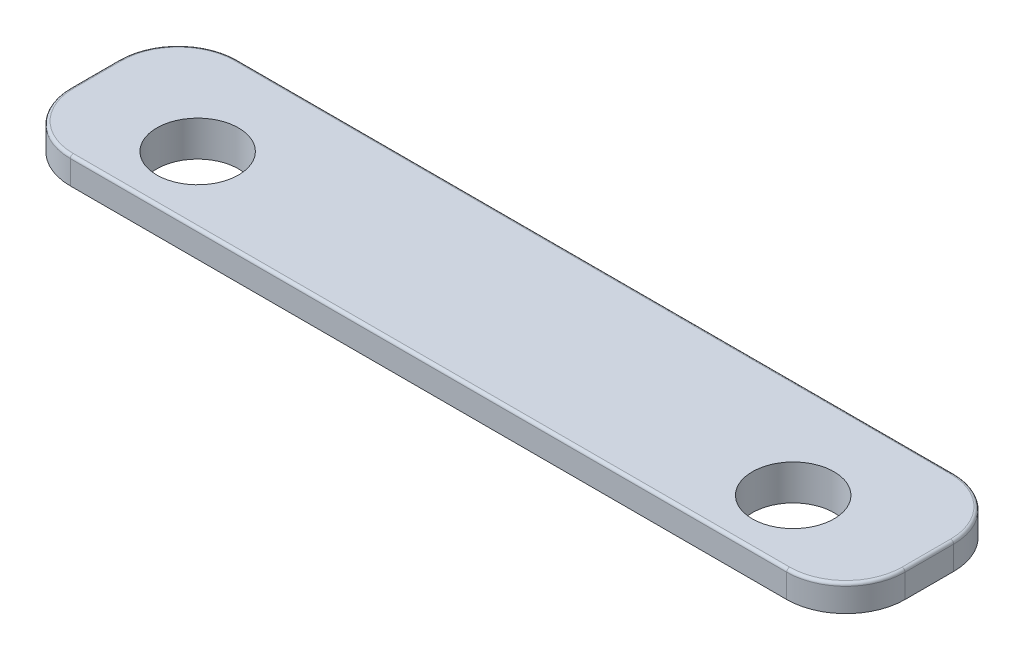
from build123d import *

# Parameters (mm, degrees)
SKETCH1_W           = 35.814
SKETCH1_H           = 7.1628
BOSS_EXTRUDE1_DEPTH = 1.524
FILLET1_R           = 2.54
FILLET2_R           = 0.127
BOSS_EXTRUDE2_DEPTH = 0.381
SKETCH5_R           = 1.2827
CUT_EXTRUDE2_DEPTH  = 2.54
SKETCH9_R           = 1.7526
CUT_EXTRUDE5_DEPTH  = 1.016
CUT_EXTRUDE6_START  = -0.381
CUT_EXTRUDE6_DEPTH  = 0.381
SKETCH17_R          = 1.7526
CUT_EXTRUDE11_DEPTH = 19.289869627
SKETCH18_R          = 1.7526
CUT_EXTRUDE12_DEPTH = 19.325109849
SKETCH19_R          = 0.381
CUT_EXTRUDE13_DEPTH = 0.127
SKETCH20_R          = 0.1905
CUT_EXTRUDE14_DEPTH = 0.762


with BuildPart() as part:
    # Sketch1 → Boss-Extrude1 (new body)
    with BuildSketch(Plane(origin=(0, 0, 0), x_dir=(1, 0, 0), z_dir=(0, 1, 0))):
        Rectangle(SKETCH1_W, SKETCH1_H)
    extrude(amount=BOSS_EXTRUDE1_DEPTH)

    # Fillet1
    fillet1_edges = [part.edges().sort_by_distance(p)[0] for p in [
        (-17.907, 0.762, -3.5814),
        (17.907, 0.762, -3.5814),
        (17.907, 0.762, 3.5814),
        (-17.907, 0.762, 3.5814),
    ]]
    fillet(fillet1_edges, radius=FILLET1_R)

    # Fillet2
    fillet2_edges = [part.edges().sort_by_distance(p)[0] for p in [
        (-17.907, 1.524, 0),
        (0, 1.524, -3.5814),
        (0, 1.524, 3.5814),
        (17.907, 1.524, 0),
        (17.163051224, 1.524, 2.837451224),
        (17.163051224, 1.524, -2.837451224),
        (-17.163051224, 1.524, 2.837451224),
        (-17.163051224, 1.524, -2.837451224),
    ]]
    fillet(fillet2_edges, radius=FILLET2_R)

    # Sketch4 → Boss-Extrude2 (add)
    with BuildSketch(Plane.XZ.offset(-0.381)):
        with BuildLine():
            Line((-15.367, 2.9464), (-15.367, 3.2004))
            ThreePointArc((-15.367, 3.2004), (-16.893643541, 2.568043541), (-17.526, 1.0414))
            Line((-17.526, 1.0414), (-17.526, -1.0414))
            ThreePointArc((-17.526, -1.0414), (-16.893643541, -2.568043541), (-15.367, -3.2004))
            Line((-15.367, -3.2004), (-15.367, -2.9464))
            ThreePointArc((-15.367, -2.9464), (-16.714038418, -2.388438418), (-17.272, -1.0414))
            Line((-17.272, -1.0414), (-17.272, 1.0414))
            ThreePointArc((-17.272, 1.0414), (-16.714038418, 2.388438418), (-15.367, 2.9464))
        make_face()
    boss_extrude2 = extrude(amount=BOSS_EXTRUDE2_DEPTH)

    # Mirror3: Boss-Extrude2 across plane
    add(boss_extrude2.mirror(Plane(origin=(0, 0, 0), x_dir=(0, 0, 1), z_dir=(1, 0, 0))))

    # Sketch5 → Cut-Extrude2 (cut)
    with BuildSketch(Plane(origin=(0, 1.524, 0), x_dir=(1, 0, 0), z_dir=(0, 1, 0))):
        with Locations(Location((-12.7762, -0.7112, 0), (0, 0, 270))):
            Circle(SKETCH5_R)
    cut_extrude2 = extrude(amount=-CUT_EXTRUDE2_DEPTH, mode=Mode.SUBTRACT)

    # Sketch9 → Cut-Extrude5 (cut)
    with BuildSketch(Plane(origin=(0, 1.524, 0), x_dir=(1, 0, 0), z_dir=(0, 1, 0))):
        with Locations(Location((-12.7762, -0.7112, 0), (0, 0, 270))):
            Circle(SKETCH9_R)
    cut_extrude5 = extrude(amount=-CUT_EXTRUDE5_DEPTH, mode=Mode.SUBTRACT)

    # Mirror4: Cut-Extrude2, Cut-Extrude5 across plane
    add(cut_extrude2.mirror(Plane(origin=(0, 0, 0), x_dir=(0, 0, 1), z_dir=(1, 0, 0))), mode=Mode.SUBTRACT)
    add(cut_extrude5.mirror(Plane(origin=(0, 0, 0), x_dir=(0, 0, 1), z_dir=(1, 0, 0))), mode=Mode.SUBTRACT)

    # Sketch10 → Cut-Extrude6 (cut)
    with BuildSketch(Plane.XZ.offset(CUT_EXTRUDE6_START)):
        with BuildLine():
            Line((17.907, 1.0414), (17.907, -1.0414))
            ThreePointArc((17.907, -1.0414), (17.163051224, -2.837451224), (15.367, -3.5814))
            Line((15.367, -3.5814), (-15.367, -3.5814))
            ThreePointArc((-15.367, -3.5814), (-17.163051224, -2.837451224), (-17.907, -1.0414))
            Line((-17.907, -1.0414), (-17.907, 1.0414))
            ThreePointArc((-17.907, 1.0414), (-17.163051224, 2.837451224), (-15.367, 3.5814))
            Line((-15.367, 3.5814), (15.367, 3.5814))
            ThreePointArc((15.367, 3.5814), (17.163051224, 2.837451224), (17.907, 1.0414))
        make_face()
        with BuildLine():
            Line((-15.367, 2.9464), (15.367, 2.9464))
            ThreePointArc((15.367, 2.9464), (16.714038418, 2.388438418), (17.272, 1.0414))
            Line((17.272, 1.0414), (17.272, -1.0414))
            ThreePointArc((17.272, -1.0414), (16.714038418, -2.388438418), (15.367, -2.9464))
            Line((15.367, -2.9464), (-15.367, -2.9464))
            ThreePointArc((-15.367, -2.9464), (-16.714038418, -2.388438418), (-17.272, -1.0414))
            Line((-17.272, -1.0414), (-17.272, 1.0414))
            ThreePointArc((-17.272, 1.0414), (-16.714038418, 2.388438418), (-15.367, 2.9464))
        make_face(mode=Mode.SUBTRACT)
    extrude(amount=CUT_EXTRUDE6_DEPTH, mode=Mode.SUBTRACT)

    # Sketch17 → Cut-Extrude11 (cut, through all)
    with BuildSketch(Plane(origin=(0, 0.508, 0), x_dir=(1, 0, 0), z_dir=(0, 1, 0))):
        with Locations(Location((-12.7762, -0.7112, 0), (0, 0, 270))):
            Circle(SKETCH17_R)
    extrude(amount=-CUT_EXTRUDE11_DEPTH, mode=Mode.SUBTRACT)

    # Sketch18 → Cut-Extrude12 (cut, through all)
    with BuildSketch(Plane(origin=(0, 1.524, 0), x_dir=(1, 0, 0), z_dir=(0, 1, 0))):
        with Locations(Location((12.7762, -0.7112, 0), (0, 0, 270))):
            Circle(SKETCH18_R)
    extrude(amount=-CUT_EXTRUDE12_DEPTH, mode=Mode.SUBTRACT)

    # Sketch19 → Cut-Extrude13 (cut)
    with BuildSketch(Plane.XZ):
        with Locations(Location((0, 0.7112, 0), (0, 0, 270))):
            Circle(SKETCH19_R)
    extrude(amount=-CUT_EXTRUDE13_DEPTH, mode=Mode.SUBTRACT)

    # Sketch20 → Cut-Extrude14 (cut)
    with BuildSketch(Plane.XZ):
        with Locations(Location((0, 0.7112, 0), (0, 0, 270))):
            Circle(SKETCH20_R)
    extrude(amount=-CUT_EXTRUDE14_DEPTH, mode=Mode.SUBTRACT)


solid = part.part
